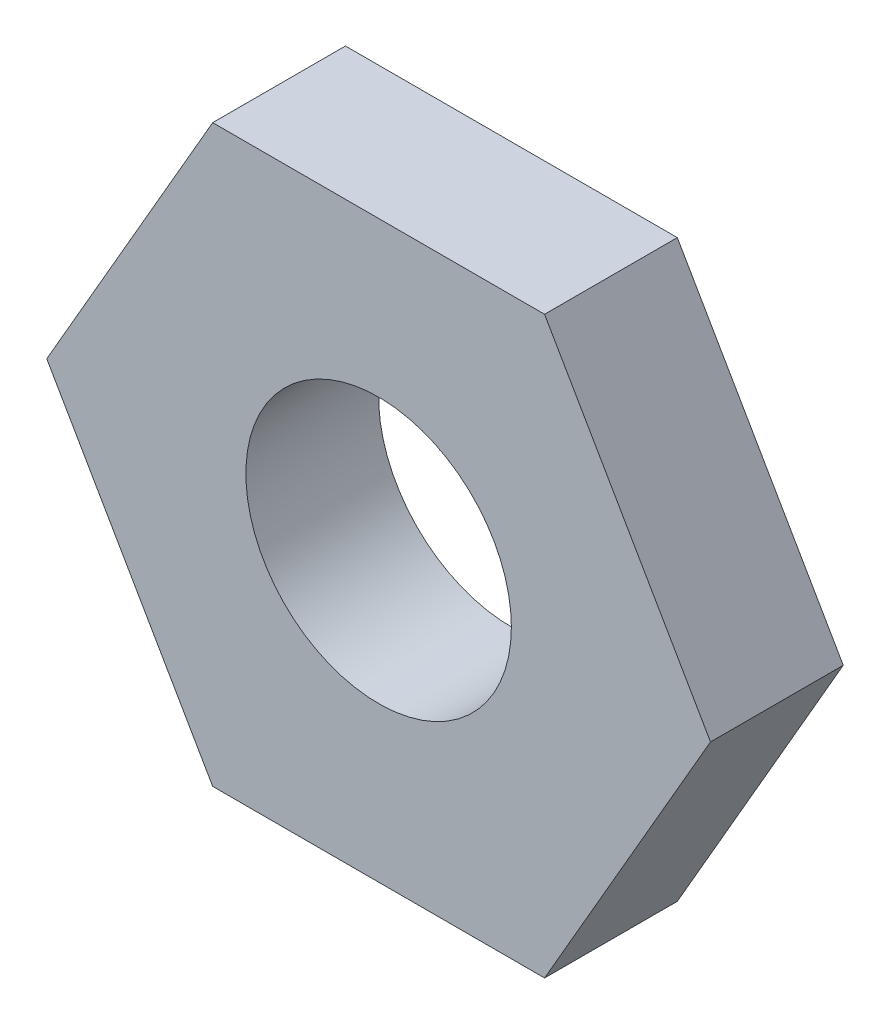
from build123d import *

# Parameters (mm, degrees)
BOSS_EXTRUDE1_DEPTH = 4
SKETCH2_R           = 4
CUT_EXTRUDE1_DEPTH  = 14.820274961


with BuildPart() as part:
    # Sketch1 → Boss-Extrude1 (new body)
    with BuildSketch(Plane.XY):
        Polygon((5, 8.660254038), (-5, 8.660254038), (-10, 0), (-5, -8.660254038), (5, -8.660254038), (10, 0), align=None)
    extrude(amount=BOSS_EXTRUDE1_DEPTH)

    # Sketch2 → Cut-Extrude1 (cut, through all)
    with BuildSketch(Plane.XY.offset(4)):
        Circle(SKETCH2_R)
    extrude(amount=-CUT_EXTRUDE1_DEPTH, mode=Mode.SUBTRACT)


solid = part.part
